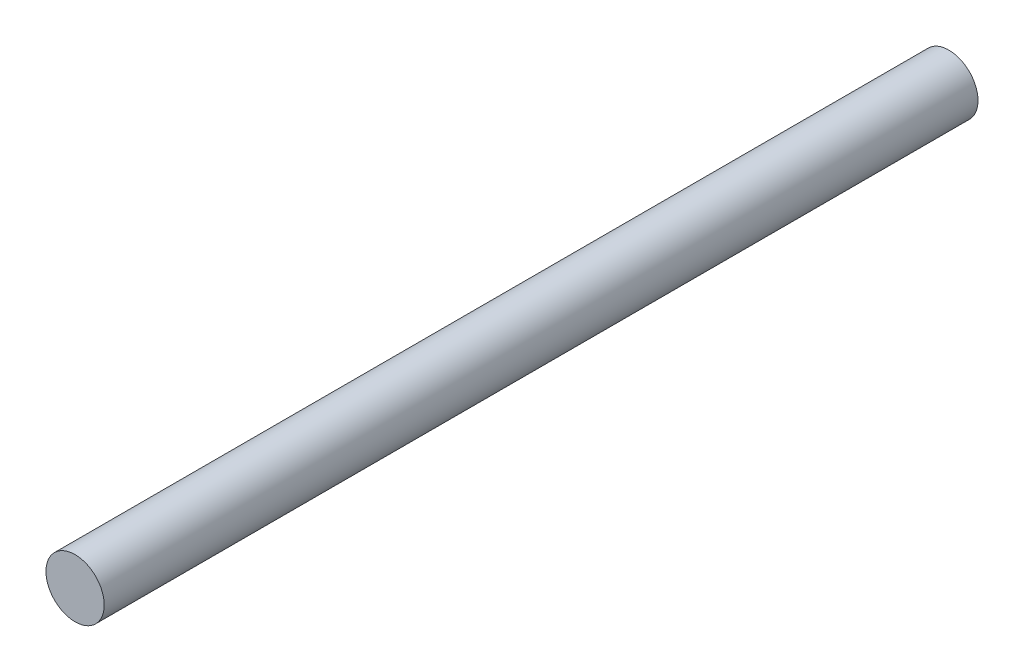
from build123d import *

# Parameters (mm, degrees)
SKETCH_1_R      = 4
EXTRUDE_2_DEPTH = 120


with BuildPart() as part:
    # Эскиз1 → Бобышка-Вытянуть2 (new body)
    with BuildSketch(Plane.XY):
        Circle(SKETCH_1_R)
    extrude(amount=EXTRUDE_2_DEPTH)


solid = part.part
